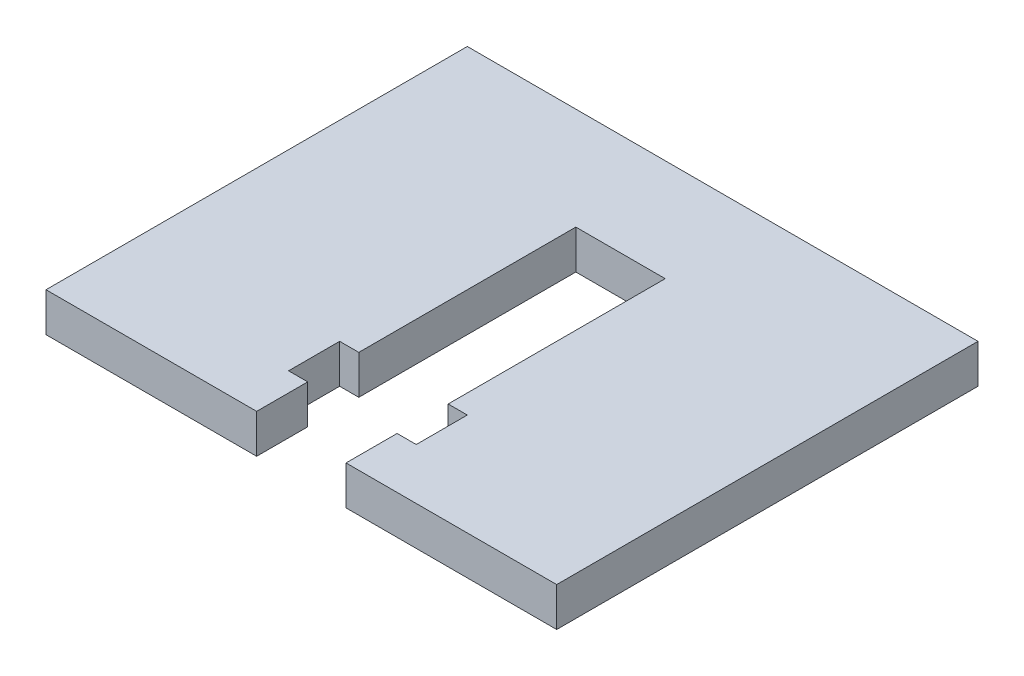
from build123d import *

# Parameters (mm, degrees)
BOSS_EXTRUDE1_DEPTH = 3.05


with BuildPart() as part:
    # Sketch1 → Boss-Extrude1 (new body)
    with BuildSketch(Plane(origin=(0, 0, 0), x_dir=(1, 0, 0), z_dir=(0, 1, 0))):
        Polygon((0, 0), (0, 33), (40, 33), (40, 0), (23.5, 0), (23.5, 4), (25, 4), (25, 8), (23.5, 8), (23.5, 25), (16.5, 25), (16.5, 8), (15, 8), (15, 4), (16.5, 4), (16.5, 0), align=None)
    extrude(amount=BOSS_EXTRUDE1_DEPTH)


solid = part.part
